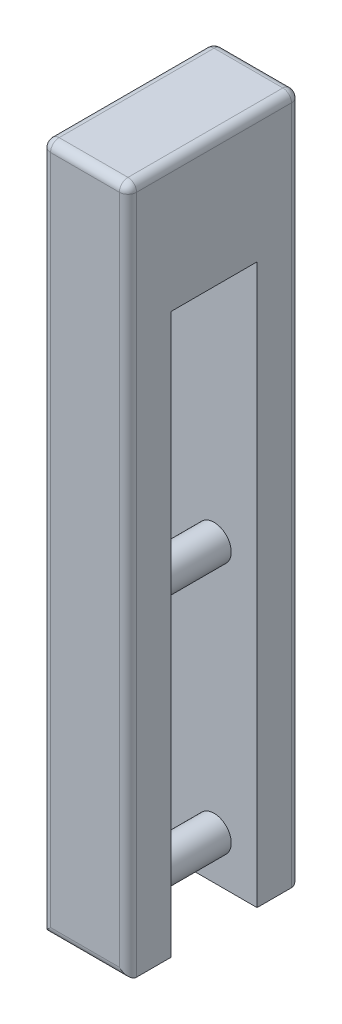
from build123d import *

# Parameters (mm, degrees)
SKETCH1_W           = 10
SKETCH1_H           = 80
BOSS_EXTRUDE1_DEPTH = 5
SKETCH2_R           = 2
BOSS_EXTRUDE2_DEPTH = 5
SKETCH3_W           = 10
SKETCH3_H           = 15
BOSS_EXTRUDE4_DEPTH = 10
FILLET1_R           = 1


with BuildPart() as part:
    # Sketch1 → Boss-Extrude1 (new body)
    with BuildSketch(Plane.XY):
        with Locations((5, 40)):
            Rectangle(SKETCH1_W, SKETCH1_H)
    boss_extrude1 = extrude(amount=BOSS_EXTRUDE1_DEPTH)

    # Sketch2 → Boss-Extrude2 (add)
    with BuildSketch(Plane.XY.offset(5)):
        with Locations(Location((5, 5, 0), (0, 0, 180))):
            Circle(SKETCH2_R)
        with Locations(Location((5, 34.285714286, 0), (0, 0, 180))):
            Circle(SKETCH2_R)
    boss_extrude2 = extrude(amount=BOSS_EXTRUDE2_DEPTH)

    # Mirror2: Boss-Extrude1, Boss-Extrude2 across plane
    add(boss_extrude1.mirror(Plane(origin=(5, 34.285714286, 10), x_dir=(1, 0, 0), z_dir=(0, 0, 1))))
    add(boss_extrude2.mirror(Plane(origin=(5, 34.285714286, 10), x_dir=(1, 0, 0), z_dir=(0, 0, 1))))

    # Sketch3 → Boss-Extrude4 (add)
    with BuildSketch(Plane.XY.offset(5)):
        with Locations((5, 72.5)):
            Rectangle(SKETCH3_W, SKETCH3_H)
    extrude(amount=BOSS_EXTRUDE4_DEPTH)

    # Fillet1
    fillet1_edges = [part.edges().sort_by_distance(p)[0] for p in [
        (0, 40, 20),
        (5, 0, 20),
        (10, 40, 20),
        (5, 80, 20),
        (5, 80, 0),
        (10, 40, 0),
        (5, 0, 0),
        (0, 40, 0),
        (0, 80, 10),
        (10, 80, 10),
    ]]
    fillet(fillet1_edges, radius=FILLET1_R)


solid = part.part
